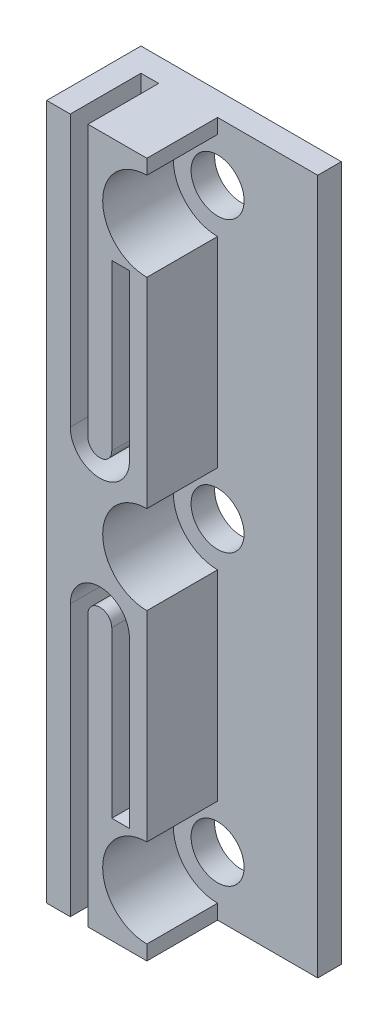
from build123d import *

# Parameters (mm, degrees)
ESQUISSE1_W             = 17
ESQUISSE1_H             = 59
BOSS_EXTRU_1_DEPTH      = 2
ESQUISSE2_W             = 8.5
ESQUISSE2_H             = 59
BOSS_EXTRU_2_DEPTH      = 6
ESQUISSE3_W             = 1.5
ESQUISSE3_H             = 23
ESQUISSE3_H_2           = 14
ENL_V_MAT_EXTRU_1_DEPTH = 6
ESQUISSE4_R             = 2.25
ENL_V_MAT_EXTRU_4_DEPTH = 22
ESQUISSE6_R             = 3.75
ENL_V_MAT_EXTRU_5_DEPTH = 6


with BuildPart() as part:
    # Esquisse1 → Boss.-Extru.1 (new body)
    with BuildSketch(Plane.XY):
        with Locations((8.5, -29.5)):
            Rectangle(ESQUISSE1_W, ESQUISSE1_H)
    extrude(amount=BOSS_EXTRU_1_DEPTH)

    # Esquisse2 → Boss.-Extru.2 (add)
    with BuildSketch(Plane.XY.offset(2)):
        with Locations((4.25, -29.5)):
            Rectangle(ESQUISSE2_W, ESQUISSE2_H)
    extrude(amount=BOSS_EXTRU_2_DEPTH)

    # Esquisse3 → Enlèv. mat.-Extru.1 (cut)
    with BuildSketch(Plane.XY.offset(8)):
        with Locations((2.75, -47.5)):
            Rectangle(ESQUISSE3_W, ESQUISSE3_H)
        with BuildLine():
            ThreePointArc((3.5, -33.702199257), (2.408191843, -34.627967907), (2, -36))
            Line((2, -36), (3.5, -36))
            Line((3.5, -36), (3.5, -33.702199257))
        make_face()
        with BuildLine():
            Line((3.5, -33.702199257), (3.5, -36))
            ThreePointArc((3.5, -36), (4.509962751, -34.990037249), (5.519925502, -36))
            Line((5.519925502, -36), (5.519925502, -33.702199257))
            ThreePointArc((5.519925502, -33.702199257), (4.509962751, -33.490037249), (3.5, -33.702199257))
        make_face()
        with BuildLine():
            Line((5.519925502, -33.702199257), (5.519925502, -36))
            Line((5.519925502, -36), (7.019925502, -36))
            ThreePointArc((7.019925502, -36), (6.611733659, -34.627967907), (5.519925502, -33.702199257))
        make_face()
        with Locations((6.269925502, -43)):
            Rectangle(ESQUISSE3_W, ESQUISSE3_H_2)
        with Locations((6.269925502, -16)):
            Rectangle(ESQUISSE3_W, ESQUISSE3_H_2)
        with Locations((2.75, -11.5)):
            Rectangle(ESQUISSE3_W, ESQUISSE3_H)
        with BuildLine():
            Line((3.5, -23), (2, -23))
            ThreePointArc((2, -23), (2.408191843, -24.372032093), (3.5, -25.297800743))
            Line((3.5, -25.297800743), (3.5, -23))
        make_face()
        with BuildLine():
            ThreePointArc((5.519925502, -23), (4.509962751, -24.009962751), (3.5, -23))
            Line((3.5, -23), (3.5, -25.297800743))
            ThreePointArc((3.5, -25.297800743), (4.509962751, -25.509962751), (5.519925502, -25.297800743))
            Line((5.519925502, -25.297800743), (5.519925502, -23))
        make_face()
        with BuildLine():
            Line((7.019925502, -23), (5.519925502, -23))
            Line((5.519925502, -23), (5.519925502, -25.297800743))
            ThreePointArc((5.519925502, -25.297800743), (6.611733659, -24.372032093), (7.019925502, -23))
        make_face()
    extrude(amount=-ENL_V_MAT_EXTRU_1_DEPTH, mode=Mode.SUBTRACT)

    # Esquisse4 → Enlèv. mat.-Extru.4 (cut)
    with BuildSketch(Plane.XY.offset(8)):
        with Locations((8.5, -29.5)):
            Circle(ESQUISSE4_R)
        with Locations((8.5, -54)):
            Circle(ESQUISSE4_R)
        with Locations((8.5, -5)):
            Circle(ESQUISSE4_R)
    extrude(amount=-ENL_V_MAT_EXTRU_4_DEPTH, mode=Mode.SUBTRACT)

    # Esquisse6 → Enlèv. mat.-Extru.5 (cut)
    with BuildSketch(Plane.XY.offset(8)):
        with Locations((8.5, -29.5)):
            Circle(ESQUISSE6_R)
        with Locations((8.5, -5)):
            Circle(ESQUISSE6_R)
        with Locations((8.5, -54)):
            Circle(ESQUISSE6_R)
    extrude(amount=-ENL_V_MAT_EXTRU_5_DEPTH, mode=Mode.SUBTRACT)


solid = part.part
